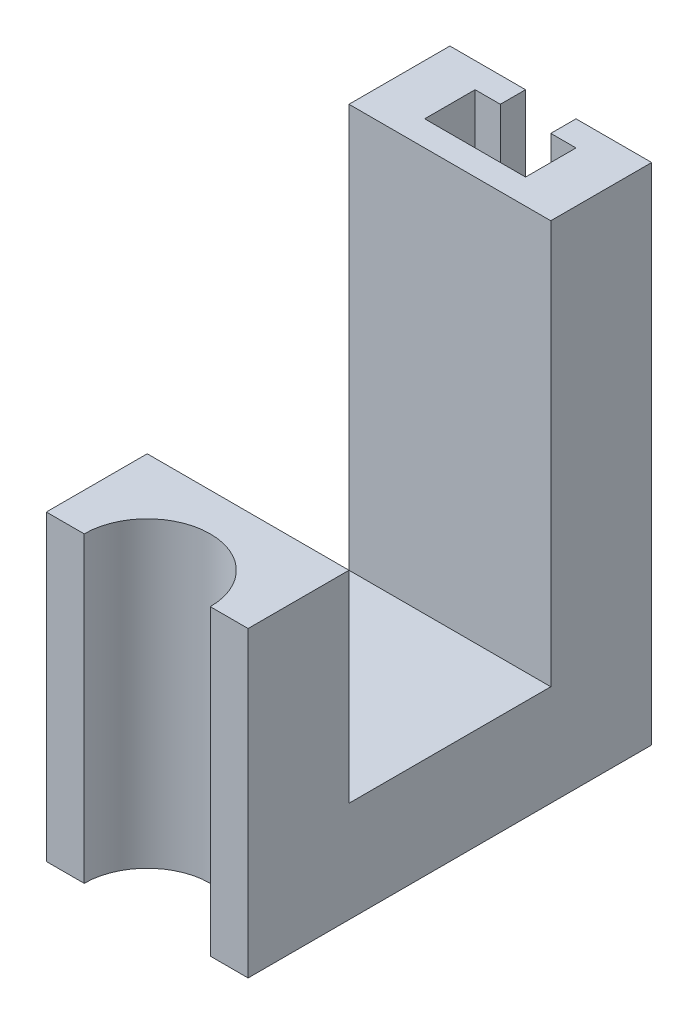
from build123d import *

# Parameters (mm, degrees)
SKETCH1_W           = 40
SKETCH1_H           = 80
BOSS_EXTRUDE1_DEPTH = 100
CUT_EXTRUDE1_REACH  = 119.319
SKETCH3_W           = 40
SKETCH3_H           = 80
CUT_EXTRUDE2_REACH  = 119.319
SKETCH5_W           = 20
SKETCH5_H           = 40
CUT_EXTRUDE3_REACH  = 114.34
SKETCH6_R           = 12.5
CUT_EXTRUDE5_REACH  = 114.34


with BuildPart() as part:
    # Sketch1 → Boss-Extrude1 (new body)
    with BuildSketch(Plane(origin=(0, 0, 0), x_dir=(1, 0, 0), z_dir=(0, 1, 0))):
        with Locations((-1.364903769, -6.515993016)):
            Rectangle(SKETCH1_W, SKETCH1_H)
    extrude(amount=BOSS_EXTRUDE1_DEPTH)

    # Sketch3 → Cut-Extrude1 (cut, up to next)
    with BuildSketch(Plane(origin=(18.635096231, 0, 0), x_dir=(0, 0, -1), z_dir=(1, 0, 0)), mode=Mode.PRIVATE) as cut_extrude1_sk1:
        with Locations((-6.515993016, 60)):
            Rectangle(SKETCH3_W, SKETCH3_H)
    cut_extrude1_tool1 = extrude(cut_extrude1_sk1.sketch, amount=-CUT_EXTRUDE1_REACH, mode=Mode.PRIVATE) & part.part
    add(cut_extrude1_tool1.solids().sort_by_distance((18.635096, 60, 6.515993))[0], mode=Mode.SUBTRACT)

    # Sketch5 → Cut-Extrude2 (cut, up to next)
    with BuildSketch(Plane(origin=(18.635096231, 0, 0), x_dir=(0, 0, -1), z_dir=(1, 0, 0)), mode=Mode.PRIVATE) as cut_extrude2_sk1:
        with Locations((-36.515993016, 80)):
            Rectangle(SKETCH5_W, SKETCH5_H)
    cut_extrude2_tool1 = extrude(cut_extrude2_sk1.sketch, amount=-CUT_EXTRUDE2_REACH, mode=Mode.PRIVATE) & part.part
    add(cut_extrude2_tool1.solids().sort_by_distance((18.635096, 80, 36.515993))[0], mode=Mode.SUBTRACT)

    # Sketch6 → Cut-Extrude3 (cut, up to next)
    with BuildSketch(Plane.XZ, mode=Mode.PRIVATE) as cut_extrude3_sk1:
        with Locations((-1.364903769, 46.515993016)):
            Circle(SKETCH6_R)
    cut_extrude3_tool1 = extrude(cut_extrude3_sk1.sketch, amount=-CUT_EXTRUDE3_REACH, mode=Mode.PRIVATE) & part.part
    add(cut_extrude3_tool1.solids().sort_by_distance((-1.364904, 0, 46.515993))[0], mode=Mode.SUBTRACT)

    # Sketch10 → Cut-Extrude5 (cut, up to next)
    with BuildSketch(Plane.XZ, mode=Mode.PRIVATE) as cut_extrude5_sk1:
        Polygon((-11.364903769, -18.484006984), (8.635096231, -18.484006984), (8.635096231, -28.484006984), (3.635096231, -28.484006984), (3.635096231, -33.484006984), (-6.364903769, -33.484006984), (-6.364903769, -28.484006984), (-11.364903769, -28.484006984), align=None)
    cut_extrude5_tool1 = extrude(cut_extrude5_sk1.sketch, amount=-CUT_EXTRUDE5_REACH, mode=Mode.PRIVATE) & part.part
    add(cut_extrude5_tool1.solids().sort_by_distance((-1.364904, 0, -24.984007))[0], mode=Mode.SUBTRACT)


solid = part.part
